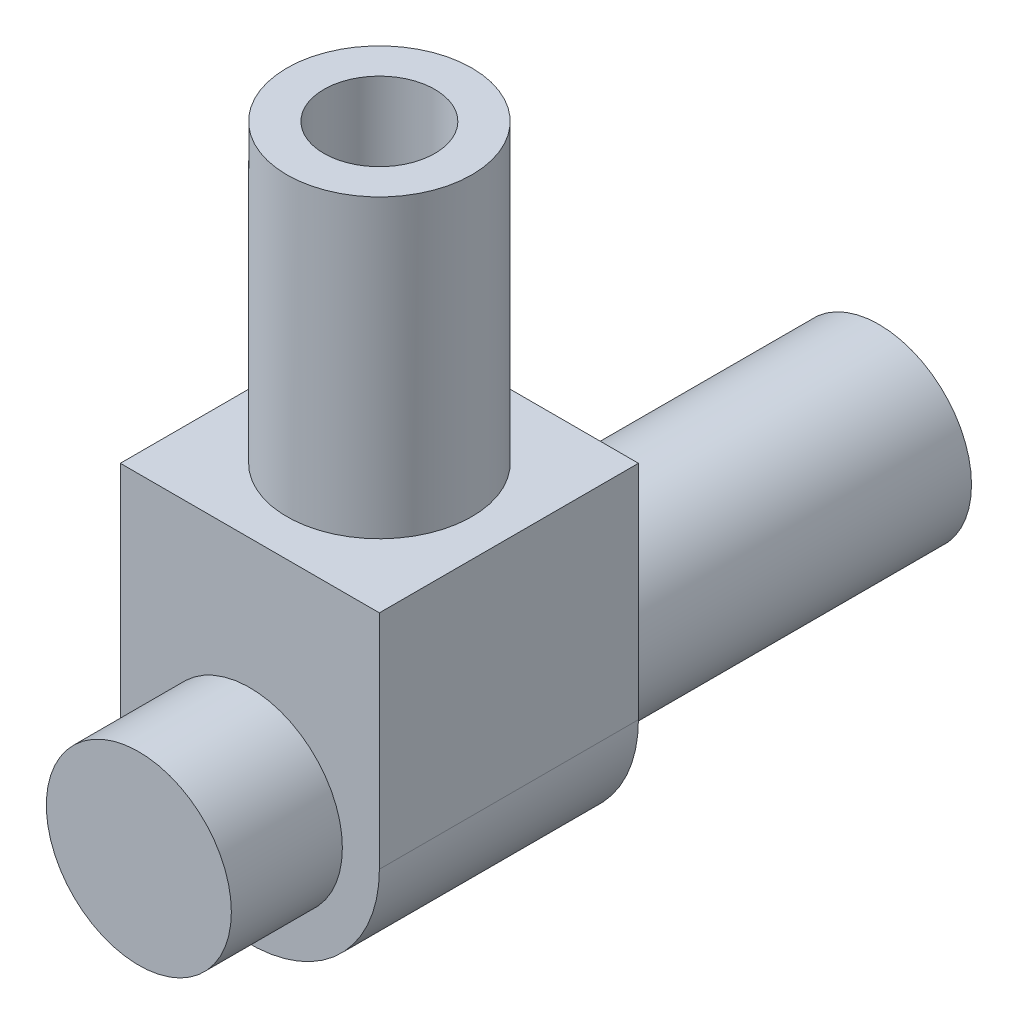
from build123d import *

# Parameters (mm, degrees)
EXTRUDE_1_DEPTH     = 7
SKETCH_3_R          = 2.5
EXTRUDE_2_DEPTH     = 3
EXTRUDE_START       = 10
SKETCH_4_R          = 2.5
EXTRUDE_3_DEPTH     = 10
SKETCH_5_R          = 2.5
SKETCH_5_R_2        = 1.5
EXTRUDE_5_DEPTH     = 8
SKETCH_6_R          = 1.5
CUT_EXTRUDE_6_DEPTH = 15.230249471


with BuildPart() as part:
    # 草圖1 → 伸長1 (new body)
    with BuildSketch(Plane.XY):
        with BuildLine():
            Line((-3.5, 0), (-3.5, 6))
            Line((-3.5, 6), (3.5, 6))
            Line((3.5, 6), (3.5, 0))
            ThreePointArc((3.5, 0), (0, -3.5), (-3.5, 0))
        make_face()
    extrude(amount=EXTRUDE_1_DEPTH)

    # 草圖3 → 伸長2 (add)
    with BuildSketch(Plane.XY.offset(7)):
        Circle(SKETCH_3_R)
    extrude(amount=EXTRUDE_2_DEPTH)

    # 草圖4 → 伸長3 (add)
    with BuildSketch(Plane(origin=(0, 0, 0), x_dir=(-1, 0, 0), z_dir=(0, 0, -1)).offset(EXTRUDE_START)):
        with Locations(Location((0, 0, 0), (0, 0, 180))):
            Circle(SKETCH_4_R)
    extrude(amount=-EXTRUDE_3_DEPTH)

    # 草圖5 → 伸長5 (add)
    with BuildSketch(Plane(origin=(0, 6, 0), x_dir=(1, 0, 0), z_dir=(0, 1, 0))):
        with Locations(Location((0, -3.5, 0), (0, 0, 90))):
            Circle(SKETCH_5_R)
        with Locations(Location((0, -3.5, 0), (0, 0, 270))):
            Circle(SKETCH_5_R_2, mode=Mode.SUBTRACT)
    extrude(amount=EXTRUDE_5_DEPTH)

    # 草圖6 → 伸長6 (cut, through all)
    with BuildSketch(Plane(origin=(0, 6, 0), x_dir=(1, 0, 0), z_dir=(0, 1, 0))):
        with Locations(Location((0, -3.5, 0), (0, 0, 270))):
            Circle(SKETCH_6_R)
    extrude(amount=-CUT_EXTRUDE_6_DEPTH, mode=Mode.SUBTRACT)


solid = part.part
